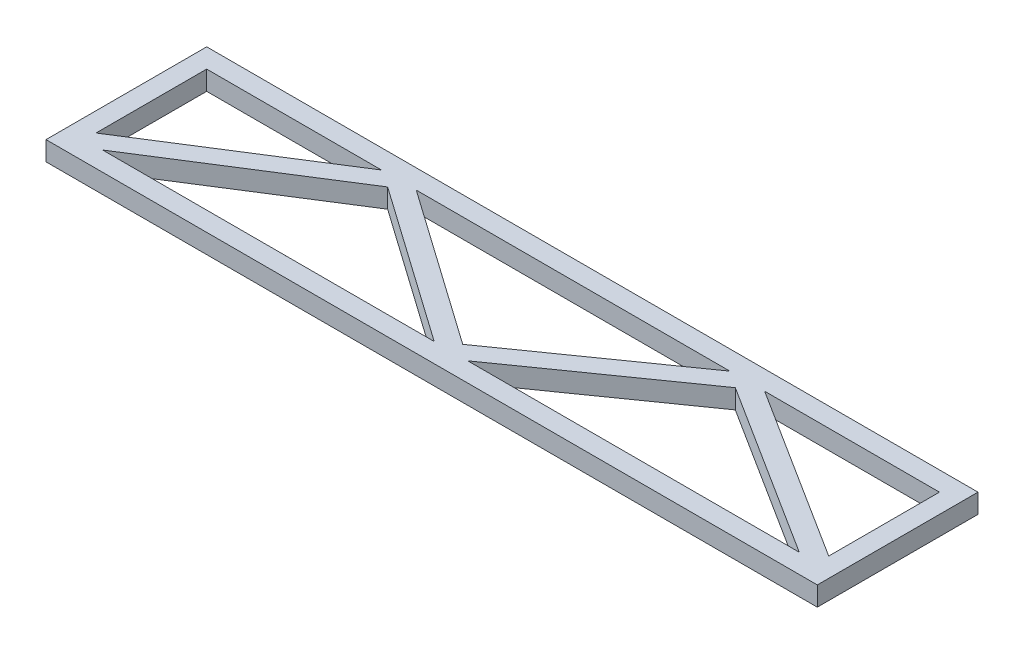
from build123d import *

# Parameters (mm, degrees)
SKETCH1_W           = 120
SKETCH1_H           = 25
BOSS_EXTRUDE1_DEPTH = 3


with BuildPart() as part:
    # Sketch1 → Boss-Extrude1 (new body)
    with BuildSketch(Plane(origin=(0, 0, 0), x_dir=(1, 0, 0), z_dir=(0, 1, 0))):
        with Locations((33.666007905, 0)):
            Rectangle(SKETCH1_W, SKETCH1_H)
        Polygon((-23.333992095, -7.72447191), (-23.333992095, 9.5), (3.862542499, 9.5), align=None, mode=Mode.SUBTRACT)
        Polygon((90.666007905, -7.72447191), (90.666007905, 9.5), (63.469473311, 9.5), align=None, mode=Mode.SUBTRACT)
        Polygon((-20.530526689, -9.5), (31.059548849, -9.5), (6.622144647, 7.696691846), align=None, mode=Mode.SUBTRACT)
        Polygon((60.709871163, 7.696691846), (36.272466961, -9.5), (87.862542499, -9.5), align=None, mode=Mode.SUBTRACT)
        Polygon((9.272466961, 9.5), (58.059548849, 9.5), (33.666007905, -7.665825109), align=None, mode=Mode.SUBTRACT)
    extrude(amount=BOSS_EXTRUDE1_DEPTH)


solid = part.part
